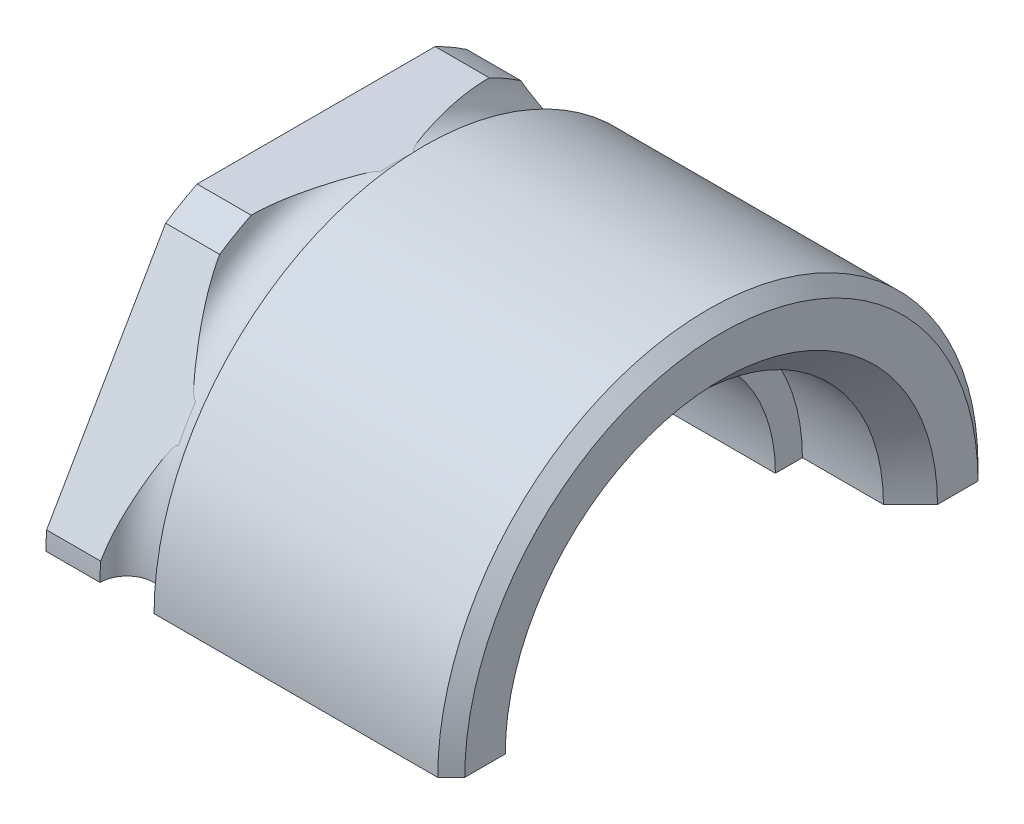
from build123d import *

# Parameters (mm, degrees)
ESQUISSE3_R             = 23.853720884
ENL_V_MAT_EXTRU_2_DEPTH = 6
ESQUISSE4_W             = 60
ESQUISSE4_H             = 84
ENL_V_MAT_EXTRU_3_DEPTH = 42.231056353


with BuildPart() as part:
    # Esquisse1 → Base-Révolution (revolve)
    with BuildSketch(Plane.XY):
        with BuildLine():
            Line((0, 12), (0, 20))
            Line((0, 20), (4, 20))
            ThreePointArc((4, 20), (6, 18), (8, 20))
            Line((8, 20), (29, 20))
            Line((29, 20), (30, 19))
            Line((30, 19), (30, 16))
            Line((30, 16), (28, 14))
            Line((28, 14), (22, 14))
            Line((22, 14), (22, 12))
            Line((22, 12), (0, 12))
        make_face()
    revolve(axis=Axis((-10, 0, 0), (1, 0, 0)))

    # Esquisse3 → Enlèv. mat.-Extru.2 (cut)
    with BuildSketch(Plane.ZY):
        Circle(ESQUISSE3_R)
        Polygon((-20.732050808, 0), (-10.366025404, 17.954482672), (10.366025404, 17.954482672), (20.732050808, 0), (10.366025404, -17.954482672), (-10.366025404, -17.954482672), align=None, mode=Mode.SUBTRACT)
    extrude(amount=-ENL_V_MAT_EXTRU_2_DEPTH, mode=Mode.SUBTRACT)

    # Esquisse4 → Enlèv. mat.-Extru.3 (cut, through all)
    with BuildSketch(Plane(origin=(0, 0, 0), x_dir=(1, 0, 0), z_dir=(0, 1, 0))):
        with Locations((20, -4)):
            Rectangle(ESQUISSE4_W, ESQUISSE4_H)
    extrude(amount=-ENL_V_MAT_EXTRU_3_DEPTH, mode=Mode.SUBTRACT)


solid = part.part
